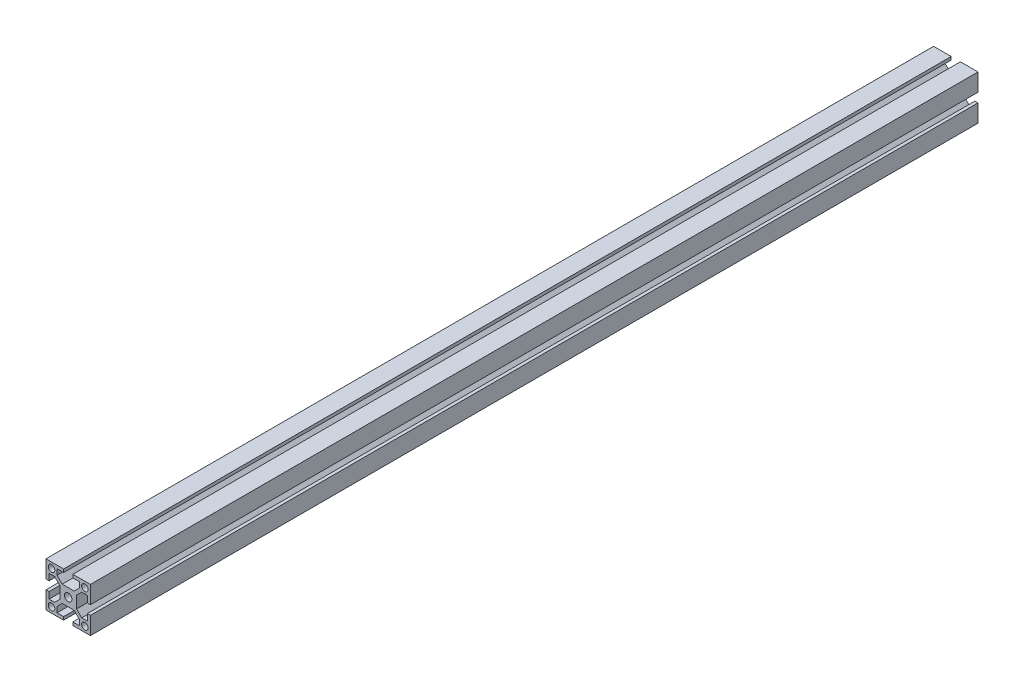
from build123d import *

# Parameters (mm, degrees)
SKETCH_1_R      = 3.4
SKETCH_1_R_2    = 2.95
EXTRUDE_1_DEPTH = 800


with BuildPart() as part:
    # 草图1 → 凸台-拉伸1 (new body)
    with BuildSketch(Plane.XY):
        Polygon((-5.389528684, -7.510849028), (5.367830629, -7.510849028), (10.039150972, -12.182169371), (10.039150972, -17.210849028), (4.139150972, -17.210849028), (4.139150972, -20.010849028), (19.989150972, -20.010849028), (19.989150972, -4.160849028), (17.189150972, -4.160849028), (17.189150972, -10.060849028), (12.160471316, -10.060849028), (7.489150972, -5.389528684), (7.489150972, 5.367830629), (12.160471316, 10.039150972), (17.189150972, 10.039150972), (17.189150972, 4.139150972), (19.989150972, 4.139150972), (19.989150972, 19.989150972), (4.139150972, 19.989150972), (4.139150972, 17.189150972), (10.039150972, 17.189150972), (10.039150972, 12.160471316), (5.367830629, 7.489150972), (-5.389528684, 7.489150972), (-10.060849028, 12.160471316), (-10.060849028, 17.189150972), (-4.160849028, 17.189150972), (-4.160849028, 19.989150972), (-20.010849028, 19.989150972), (-20.010849028, 4.139150972), (-17.210849028, 4.139150972), (-17.210849028, 10.039150972), (-12.182169371, 10.039150972), (-7.510849028, 5.367830629), (-7.510849028, -5.389528684), (-12.182169371, -10.060849028), (-17.210849028, -10.060849028), (-17.210849028, -4.160849028), (-20.010849028, -4.160849028), (-20.010849028, -20.010849028), (-4.160849028, -20.010849028), (-4.160849028, -17.210849028), (-10.060849028, -17.210849028), (-10.060849028, -12.182169371), align=None)
        with Locations((-0.010849028, -0.010849028)):
            Circle(SKETCH_1_R, mode=Mode.SUBTRACT)
        with Locations((15.014150972, 15.014150972)):
            Circle(SKETCH_1_R_2, mode=Mode.SUBTRACT)
        with Locations(Location((-15.035849028, 15.014150972, 0), (0, 0, 180))):
            Circle(SKETCH_1_R_2, mode=Mode.SUBTRACT)
        with Locations((-15.035849028, -15.035849028)):
            Circle(SKETCH_1_R_2, mode=Mode.SUBTRACT)
        with Locations(Location((15.014150972, -15.035849028, 0), (0, 0, 180))):
            Circle(SKETCH_1_R_2, mode=Mode.SUBTRACT)
    extrude(amount=EXTRUDE_1_DEPTH)


solid = part.part
